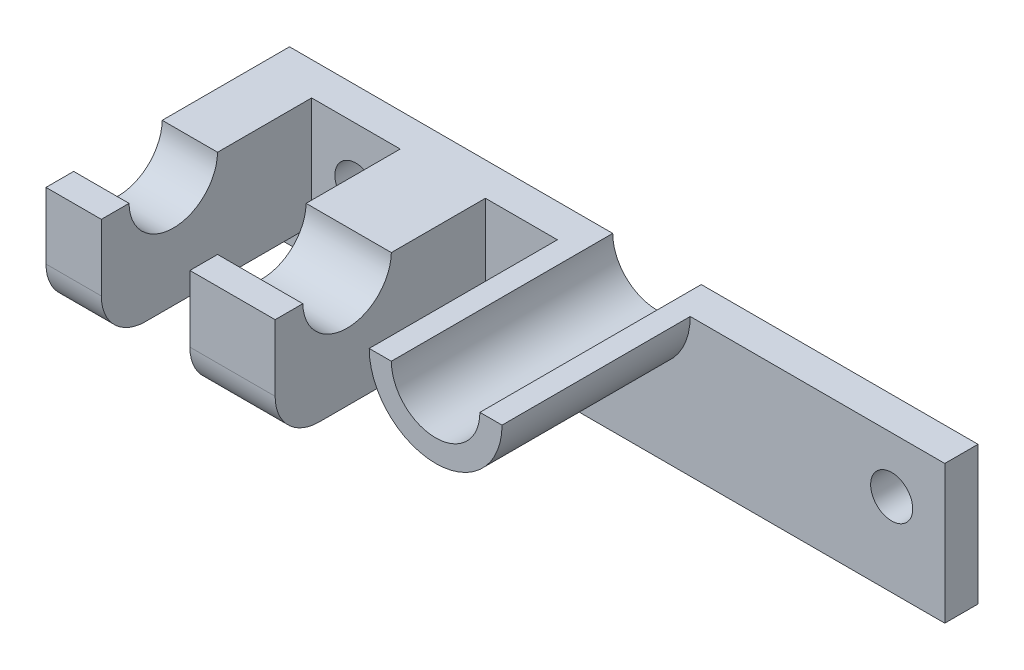
from build123d import *

# Parameters (mm, degrees)
SKETCH1_W           = 58
SKETCH1_H           = 25
SKETCH1_R           = 1.9
BOSS_EXTRUDE1_DEPTH = 3
SKETCH2_R           = 6
BOSS_EXTRUDE2_DEPTH = 20
SKETCH3_R           = 4
CUT_EXTRUDE1_DEPTH  = 38.379807383
SKETCH4_W           = 7.7
SKETCH4_H           = 19.996282454
BOSS_EXTRUDE3_DEPTH = 19
CUT_EXTRUDE2_REACH  = 57.325
SKETCH5_R           = 4
FILLET1_R           = 4
SKETCH7_W           = 4.2
SKETCH7_H           = 25
BOSS_EXTRUDE4_DEPTH = 3
SKETCH8_W           = 5
SKETCH8_H           = 19.996282454
BOSS_EXTRUDE5_DEPTH = 19
CUT_EXTRUDE3_REACH  = 64.547
SKETCH9_R           = 4
FILLET2_R           = 4
SKETCH10_W          = 62.2
SKETCH10_H          = 12.5
CUT_EXTRUDE4_DEPTH  = 42.74314315


with BuildPart() as part:
    # Sketch1 → Boss-Extrude1 (new body)
    with BuildSketch(Plane.XY):
        Rectangle(SKETCH1_W, SKETCH1_H)
        with Locations((24.2, 5)):
            Circle(SKETCH1_R, mode=Mode.SUBTRACT)
        with Locations((24.2, -5)):
            Circle(SKETCH1_R, mode=Mode.SUBTRACT)
        with Locations((-24.2, 5)):
            Circle(SKETCH1_R, mode=Mode.SUBTRACT)
        with Locations((-24.2, -5)):
            Circle(SKETCH1_R, mode=Mode.SUBTRACT)
    extrude(amount=BOSS_EXTRUDE1_DEPTH)

    # Sketch2 → Boss-Extrude2 (add)
    with BuildSketch(Plane.XY):
        Circle(SKETCH2_R)
    extrude(amount=BOSS_EXTRUDE2_DEPTH)

    # Sketch3 → Cut-Extrude1 (cut, through all)
    with BuildSketch(Plane.XY.offset(20)):
        Circle(SKETCH3_R)
    extrude(amount=-CUT_EXTRUDE1_DEPTH, mode=Mode.SUBTRACT)

    # Sketch4 → Boss-Extrude3 (add)
    with BuildSketch(Plane.XY.offset(3)):
        with Locations((-16.35, 0)):
            Rectangle(SKETCH4_W, SKETCH4_H)
    extrude(amount=BOSS_EXTRUDE3_DEPTH)

    # Sketch5 → Cut-Extrude2 (cut, up to next)
    with BuildSketch(Plane.ZY.offset(20.2), mode=Mode.PRIVATE) as cut_extrude2_sk1:
        with Locations((15.5, 0.080826905)):
            Circle(SKETCH5_R)
    cut_extrude2_tool1 = extrude(cut_extrude2_sk1.sketch, amount=-CUT_EXTRUDE2_REACH, mode=Mode.PRIVATE) & part.part
    add(cut_extrude2_tool1.solids().sort_by_distance((-20.2, 0.080827, 15.5))[0], mode=Mode.SUBTRACT)

    # Fillet1
    fillet1_edges = [part.edges().sort_by_distance(p)[0] for p in [
        (-16.35, 9.998141227, 22),
        (-16.35, -9.998141227, 22),
    ]]
    fillet(fillet1_edges, radius=FILLET1_R)

    # Sketch7 → Boss-Extrude4 (add)
    with BuildSketch(Plane.XY.offset(3)):
        with Locations((-31.1, 0)):
            Rectangle(SKETCH7_W, SKETCH7_H)
    extrude(amount=-BOSS_EXTRUDE4_DEPTH)

    # Sketch8 → Boss-Extrude5 (add)
    with BuildSketch(Plane.XY.offset(3)):
        with Locations((-30.7, 0)):
            Rectangle(SKETCH8_W, SKETCH8_H)
    extrude(amount=BOSS_EXTRUDE5_DEPTH)

    # Sketch9 → Cut-Extrude3 (cut, up to next)
    with BuildSketch(Plane(origin=(-28.2, 0, 0), x_dir=(0, 0, -1), z_dir=(1, 0, 0)), mode=Mode.PRIVATE) as cut_extrude3_sk1:
        with Locations(Location((-15.5, 0.063578072, 0), (0, 0, 90))):
            Circle(SKETCH9_R)
    cut_extrude3_tool1 = extrude(cut_extrude3_sk1.sketch, amount=-CUT_EXTRUDE3_REACH, mode=Mode.PRIVATE) & part.part
    add(cut_extrude3_tool1.solids().sort_by_distance((-28.2, 0.063578, 15.5))[0], mode=Mode.SUBTRACT)

    # Fillet2
    fillet2_edges = [part.edges().sort_by_distance(p)[0] for p in [
        (-30.7, 9.998141227, 22),
        (-30.7, -9.998141227, 22),
    ]]
    fillet(fillet2_edges, radius=FILLET2_R)

    # Sketch10 → Cut-Extrude4 (cut, through all)
    with BuildSketch(Plane(origin=(0, 0, 0), x_dir=(-1, 0, 0), z_dir=(0, 0, -1))):
        with Locations((2.1, 6.25)):
            Rectangle(SKETCH10_W, SKETCH10_H)
    extrude(amount=-CUT_EXTRUDE4_DEPTH, mode=Mode.SUBTRACT)


solid = part.part
